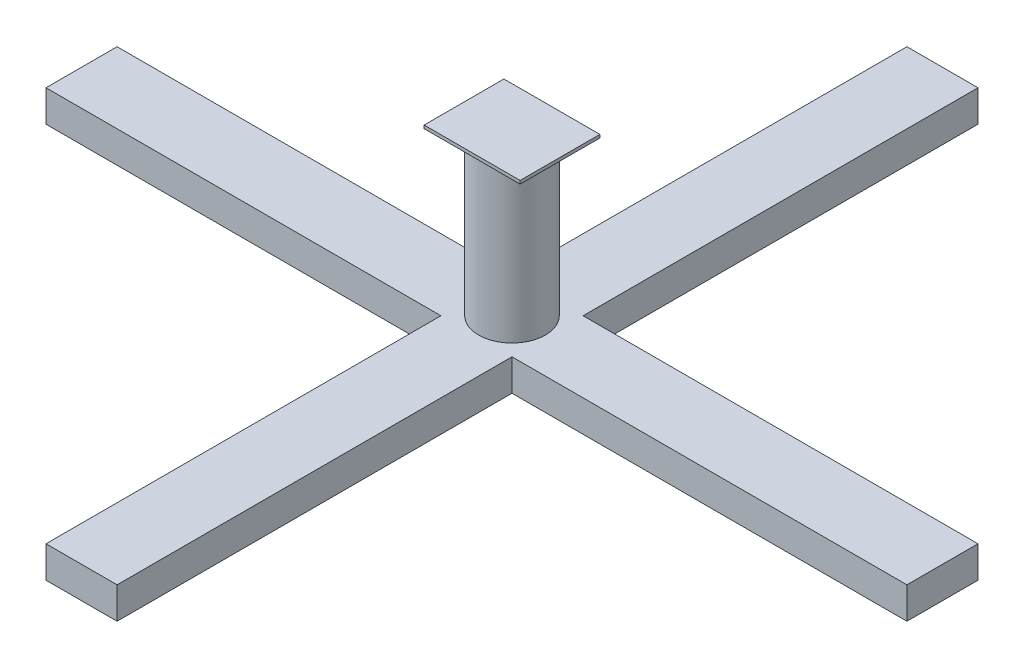
from build123d import *

# Parameters (mm, degrees)
CROQUIS1_W                   = 45
CROQUIS1_H                   = 500
CROQUIS1_W_2                 = 500
CROQUIS1_H_2                 = 45
CROQUIS1_R                   = 45
SALIENTE_EXTRUIR1_DEPTH      = 40
CROQUIS2_R                   = 42.35
SALIENTE_EXTRUIR2_DEPTH      = 200
CROQUIS3_R                   = 39.35
CORTAR_EXTRUIR1_DEPTH        = 200
SALIENTE_EXTRUIR3_DEPTH      = 4
SALIENTE_EXTRUIR3_DEPTH_BACK = 200
CROQUIS4_R                   = 39.35
CROQUIS4_R_2                 = 36.35
CROQUIS6_W                   = 121.5
CROQUIS6_H                   = 101
SALIENTE_EXTRUIR4_DEPTH      = 4


with BuildPart() as part:
    # Croquis1 → Saliente-Extruir1 (new body)
    with BuildSketch(Plane(origin=(0, 0, 0), x_dir=(1, 0, 0), z_dir=(0, 1, 0))):
        with Locations((22.5, -295)):
            Rectangle(CROQUIS1_W, CROQUIS1_H)
        with Locations((-22.5, -295)):
            Rectangle(CROQUIS1_W, CROQUIS1_H)
        with Locations((295, -22.5)):
            Rectangle(CROQUIS1_W_2, CROQUIS1_H_2)
        with Locations((295, 22.5)):
            Rectangle(CROQUIS1_W_2, CROQUIS1_H_2)
        with Locations((-295, 22.5)):
            Rectangle(CROQUIS1_W_2, CROQUIS1_H_2)
        with Locations((-295, -22.5)):
            Rectangle(CROQUIS1_W_2, CROQUIS1_H_2)
        with BuildLine():
            Line((-45, -45), (0, -45))
            ThreePointArc((0, -45), (-31.819805153, -31.819805153), (-45, 0))
            Line((-45, 0), (-45, -45))
        make_face()
        with BuildLine():
            ThreePointArc((0, 45), (31.819805153, 31.819805153), (45, 0))
            Line((45, 0), (45, 45))
            Line((45, 45), (0, 45))
        make_face()
        with BuildLine():
            ThreePointArc((-45, 0), (-31.819805153, 31.819805153), (0, 45))
            Line((0, 45), (-45, 45))
            Line((-45, 45), (-45, 0))
        make_face()
        with Locations((-22.5, 295)):
            Rectangle(CROQUIS1_W, CROQUIS1_H)
        with Locations((22.5, 295)):
            Rectangle(CROQUIS1_W, CROQUIS1_H)
        with BuildLine():
            Line((45, -45), (45, 0))
            ThreePointArc((45, 0), (31.819805153, -31.819805153), (0, -45))
            Line((0, -45), (45, -45))
        make_face()
        Circle(CROQUIS1_R)
    extrude(amount=SALIENTE_EXTRUIR1_DEPTH)

    # Croquis2 → Saliente-Extruir2 (add)
    with BuildSketch(Plane(origin=(0, 40, 0), x_dir=(1, 0, 0), z_dir=(0, 1, 0))):
        with Locations(Location((0, 0, 0), (0, 0, 270))):
            Circle(CROQUIS2_R)
    extrude(amount=SALIENTE_EXTRUIR2_DEPTH)

    # Croquis3 → Cortar-Extruir1 (cut)
    with BuildSketch(Plane(origin=(0, 240, 0), x_dir=(1, 0, 0), z_dir=(0, 1, 0))):
        with Locations(Location((0, 0, 0), (0, 0, 270))):
            Circle(CROQUIS3_R)
    extrude(amount=-CORTAR_EXTRUIR1_DEPTH, mode=Mode.SUBTRACT)

    # Croquis4 → Saliente-Extruir3 (add, two sides: drawn at the far end of the back side and taken through both)
    with BuildSketch(Plane(origin=(0, 240, 0), x_dir=(1, 0, 0), z_dir=(0, 1, 0)).offset(-SALIENTE_EXTRUIR3_DEPTH_BACK)):
        with Locations(Location((0, 0, 0), (0, 0, 270))):
            Circle(CROQUIS4_R)
        with Locations(Location((0, 0, 0), (0, 0, 270))):
            Circle(CROQUIS4_R_2, mode=Mode.SUBTRACT)
    extrude(amount=SALIENTE_EXTRUIR3_DEPTH + SALIENTE_EXTRUIR3_DEPTH_BACK)

    # Croquis6 → Saliente-Extruir4 (add)
    with BuildSketch(Plane(origin=(0, 240, 0), x_dir=(1, 0, 0), z_dir=(0, 1, 0))):
        Rectangle(CROQUIS6_W, CROQUIS6_H)
    extrude(amount=SALIENTE_EXTRUIR4_DEPTH)


solid = part.part
